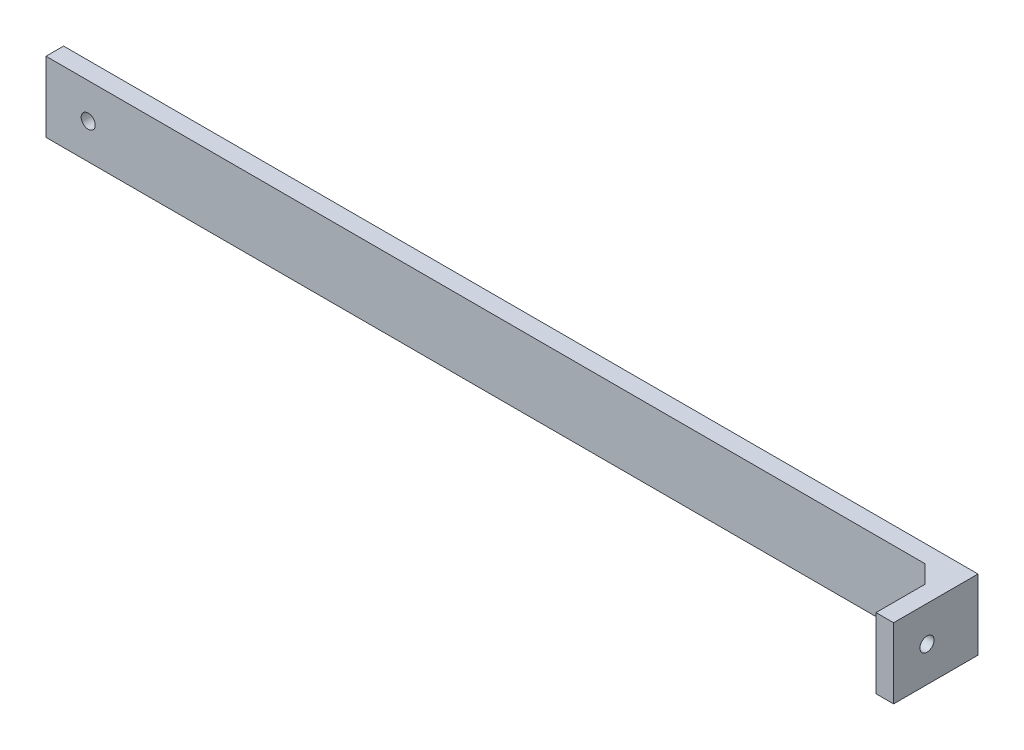
from build123d import *

# Parameters (mm, degrees)
SKETCH1_W           = 260
SKETCH1_H           = 20
BOSS_EXTRUDE1_DEPTH = 5
SKETCH2_W           = 5
SKETCH2_H           = 20
BOSS_EXTRUDE2_DEPTH = 19
SKETCH3_R           = 2
CUT_EXTRUDE1_DEPTH  = 262.296766149
SKETCH4_W           = 5
SKETCH4_H           = 5
BOSS_EXTRUDE3_DEPTH = 5
CUT_EXTRUDE2_DEPTH  = 134.701159307
SKETCH6_R           = 2
CUT_EXTRUDE3_DEPTH  = 133.574507353


with BuildPart() as part:
    # Sketch1 → Boss-Extrude1 (new body)
    with BuildSketch(Plane.XY):
        Rectangle(SKETCH1_W, SKETCH1_H)
    extrude(amount=BOSS_EXTRUDE1_DEPTH)

    # Sketch2 → Boss-Extrude2 (add)
    with BuildSketch(Plane.XY.offset(5)):
        with Locations((127.5, 0)):
            Rectangle(SKETCH2_W, SKETCH2_H)
    extrude(amount=BOSS_EXTRUDE2_DEPTH)

    # Sketch3 → Cut-Extrude1 (cut, through all)
    with BuildSketch(Plane(origin=(130, 0, 0), x_dir=(0, 0, -1), z_dir=(1, 0, 0))):
        with Locations((-14.5, 0)):
            Circle(SKETCH3_R)
    extrude(amount=-CUT_EXTRUDE1_DEPTH, mode=Mode.SUBTRACT)

    # Sketch4 → Boss-Extrude3 (add)
    with BuildSketch(Plane.ZY.offset(-125)):
        with Locations((7.5, -7.5)):
            Rectangle(SKETCH4_W, SKETCH4_H)
        with Locations((7.5, 7.5)):
            Rectangle(SKETCH4_W, SKETCH4_H)
    extrude(amount=BOSS_EXTRUDE3_DEPTH)

    # Sketch5 → Cut-Extrude2 (cut, through all)
    with BuildSketch(Plane.XZ.offset(10)):
        Polygon((120, 5), (125, 10), (120, 10), align=None)
    extrude(amount=-CUT_EXTRUDE2_DEPTH, mode=Mode.SUBTRACT)

    # Sketch6 → Cut-Extrude3 (cut, through all)
    with BuildSketch(Plane(origin=(0, 0, 0), x_dir=(-1, 0, 0), z_dir=(0, 0, -1))):
        with Locations((118, 0)):
            Circle(SKETCH6_R)
    extrude(amount=-CUT_EXTRUDE3_DEPTH, mode=Mode.SUBTRACT)


solid = part.part
